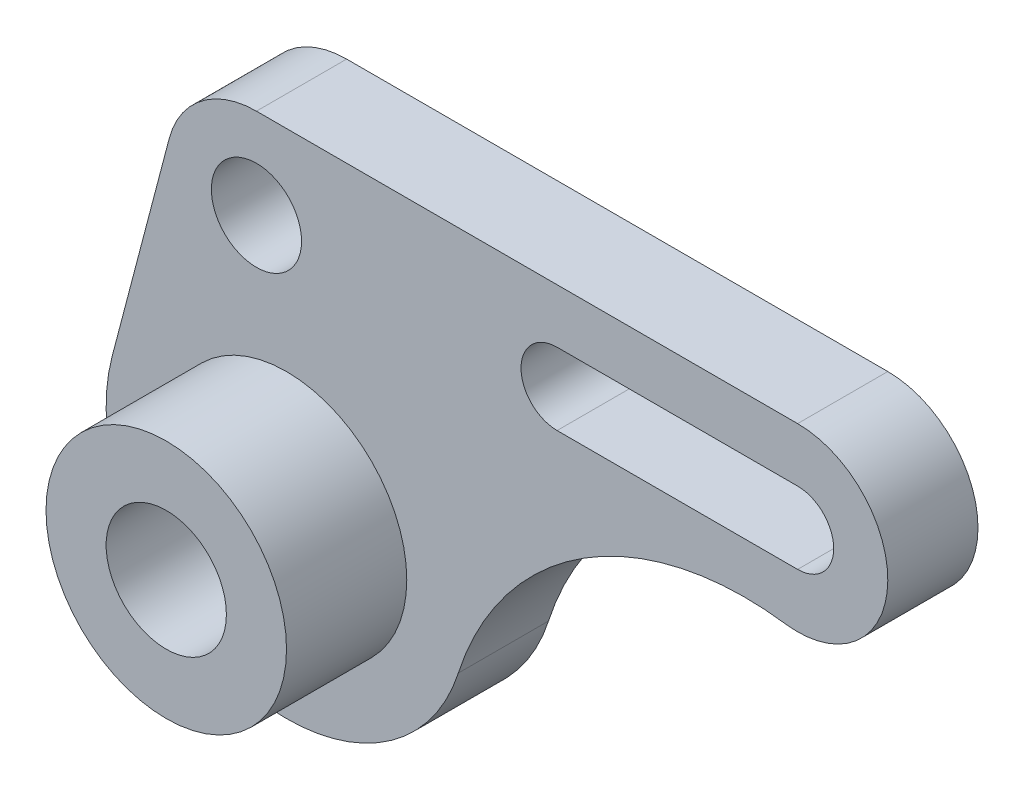
from build123d import *

# Parameters (mm, degrees)
SKETCH1_R           = 20
SKETCH1_R_2         = 7.5
BOSS_EXTRUDE1_DEPTH = 15
SKETCH1_3_R         = 20
SKETCH1_3_R_2       = 10
BOSS_EXTRUDE2_DEPTH = 35


with BuildPart() as part:
    # Sketch1 → Boss-Extrude1 (new body)
    with BuildSketch(Plane.XY):
        with BuildLine():
            ThreePointArc((37.966509351, -14.861524679), (54.965341128, -1.019100048), (40, 15))
            Line((40, 15), (-50, 15))
            ThreePointArc((-50, 15), (-59.16042736, 11.877986807), (-64.507658043, 3.811542745))
            Line((-64.507658043, 3.811542745), (-74.015316087, -32.376914511))
            ThreePointArc((-74.015316087, -32.376914511), (-53.389479092, -68.803066513), (-16.429422304, -49.149977603))
            ThreePointArc((-16.429422304, -49.149977603), (4.525739839, -22.102034478), (37.966509351, -14.861524679))
        make_face()
        with Locations((-45, -40)):
            Circle(SKETCH1_R, mode=Mode.SUBTRACT)
        with Locations((-50, 0)):
            Circle(SKETCH1_R_2, mode=Mode.SUBTRACT)
        with BuildLine():
            ThreePointArc((0, -6), (-6, 0), (0, 6))
            Line((0, 6), (40, 6))
            ThreePointArc((40, 6), (46, 0), (40, -6))
            Line((40, -6), (0, -6))
        make_face(mode=Mode.SUBTRACT)
    extrude(amount=BOSS_EXTRUDE1_DEPTH)

    # Sketch1<3> → Boss-Extrude2 (add)
    with BuildSketch(Plane.XY):
        with Locations((-45, -40)):
            Circle(SKETCH1_3_R)
        with Locations((-45, -40)):
            Circle(SKETCH1_3_R_2, mode=Mode.SUBTRACT)
    extrude(amount=BOSS_EXTRUDE2_DEPTH)


solid = part.part
